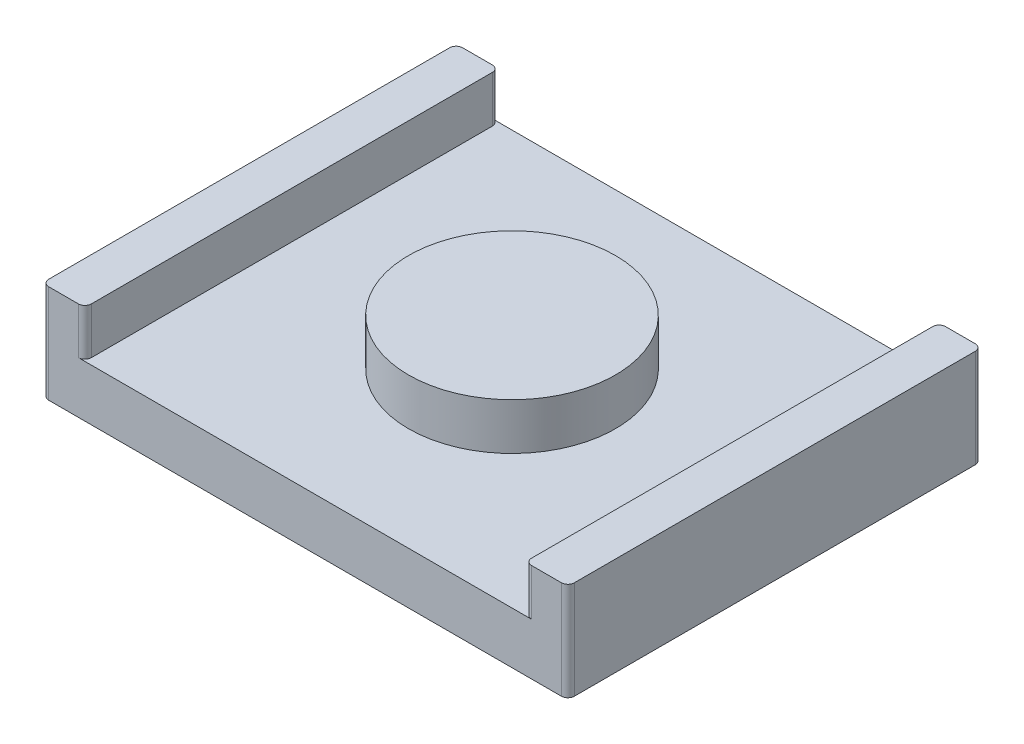
from build123d import *

# Parameters (mm, degrees)
SKETCH1_W           = 40.64
SKETCH1_H           = 32
BOSS_EXTRUDE1_DEPTH = 4
SKETCH2_R           = 8
BOSS_EXTRUDE2_DEPTH = 3.6
SKETCH3_W           = 3.3
SKETCH3_H           = 32
BOSS_EXTRUDE3_DEPTH = 3.6
FILLET1_R           = 0.5


with BuildPart() as part:
    # Sketch1 → Boss-Extrude1 (new body)
    with BuildSketch(Plane(origin=(0, 0, 0), x_dir=(1, 0, 0), z_dir=(0, 1, 0))):
        Rectangle(SKETCH1_W, SKETCH1_H)
    extrude(amount=BOSS_EXTRUDE1_DEPTH)

    # Sketch2 → Boss-Extrude2 (add)
    with BuildSketch(Plane(origin=(0, 4, 0), x_dir=(1, 0, 0), z_dir=(0, 1, 0))):
        with Locations(Location((0, 0, 0), (0, 0, 270))):
            Circle(SKETCH2_R)
    extrude(amount=BOSS_EXTRUDE2_DEPTH)

    # Sketch3 → Boss-Extrude3 (add)
    with BuildSketch(Plane(origin=(0, 4, 0), x_dir=(1, 0, 0), z_dir=(0, 1, 0))):
        with Locations((-18.67, 0)):
            Rectangle(SKETCH3_W, SKETCH3_H)
    boss_extrude3 = extrude(amount=BOSS_EXTRUDE3_DEPTH)

    # Mirror1: Boss-Extrude3 across plane
    add(boss_extrude3.mirror(Plane(origin=(0, 0, 0), x_dir=(0, 0, 1), z_dir=(1, 0, 0))))

    # Fillet1
    fillet1_edges = [part.edges().sort_by_distance(p)[0] for p in [
        (-17.02, 5.8, 16),
        (-17.02, 5.8, -16),
        (17.02, 5.8, 16),
        (17.02, 5.8, -16),
        (20.32, 3.8, 16),
        (-20.32, 3.8, 16),
        (-20.32, 3.8, -16),
        (20.32, 3.8, -16),
    ]]
    fillet(fillet1_edges, radius=FILLET1_R)


solid = part.part
